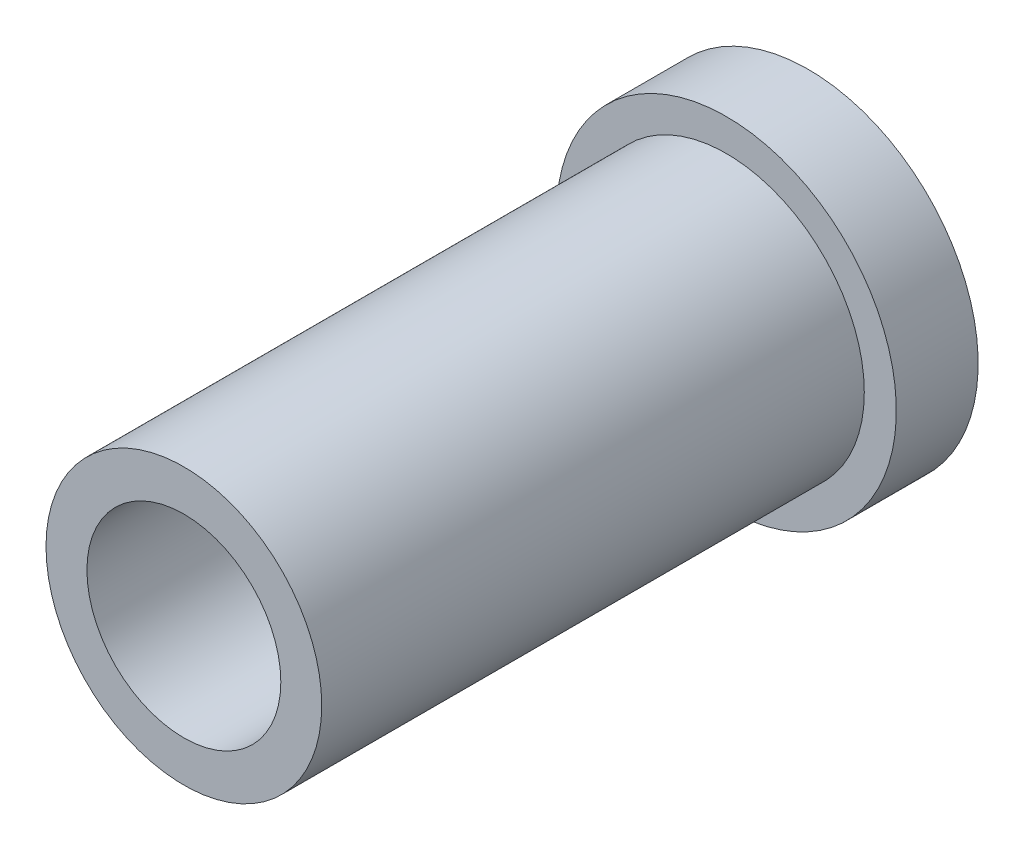
from build123d import *


with BuildPart() as part:
    # Sketch1 → Revolve1 (revolve)
    with BuildSketch(Plane(origin=(0, 0, 0), x_dir=(1, 0, 0), z_dir=(0, 1, 0))):
        Polygon((-0.545, 0.46), (-0.955, 0.46), (-0.955, 0), (-0.775, 0), (-0.775, -3.05), (-0.545, -3.05), align=None)
    revolve(axis=Axis((0, 0, -0.46), (0, 0, 1)))


solid = part.part
